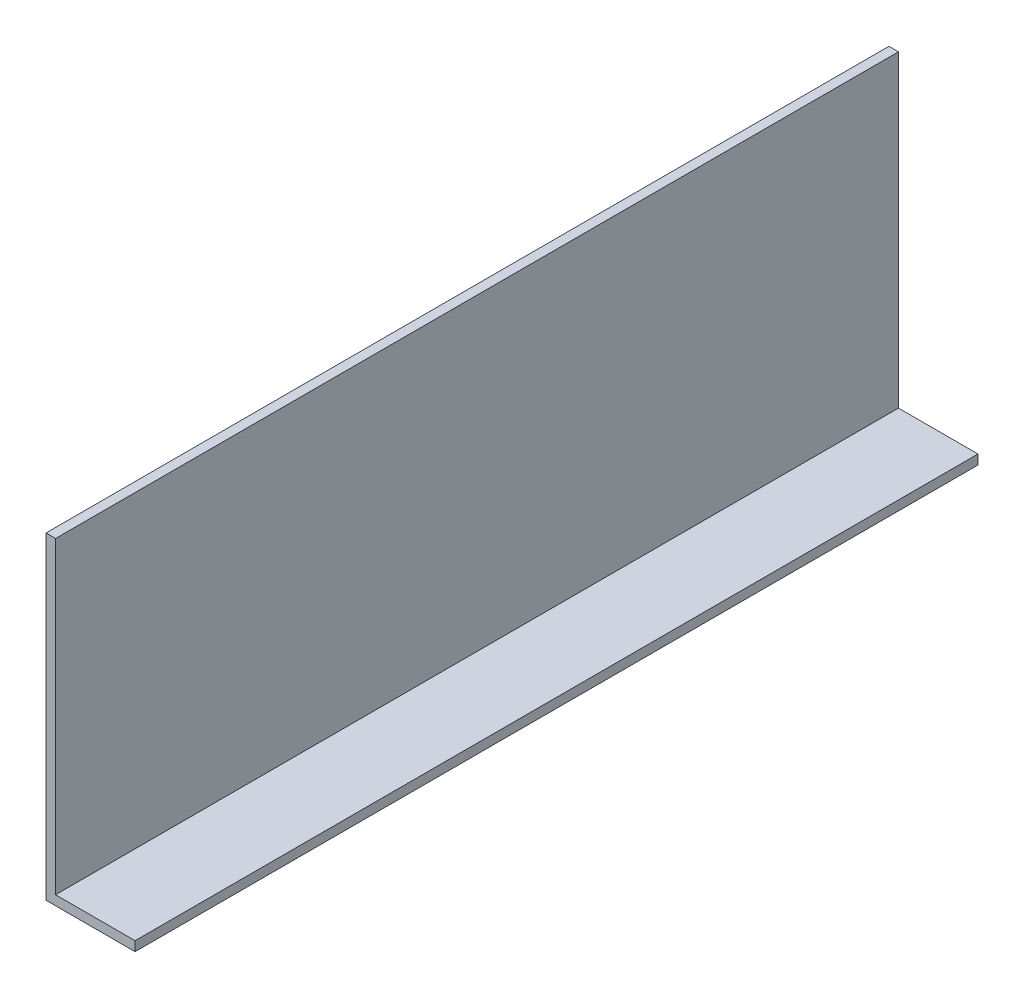
from build123d import *

# Parameters (mm, degrees)
SKETCH1_W           = 530
SKETCH1_H           = 200
BOSS_EXTRUDE1_DEPTH = 3
SKETCH2_W           = 530
SKETCH2_H           = 6
BOSS_EXTRUDE2_DEPTH = 50


with BuildPart() as part:
    # Sketch1 → Boss-Extrude1 (new, symmetric)
    with BuildSketch(Plane(origin=(0, 0, 0), x_dir=(0, 0, -1), z_dir=(1, 0, 0))):
        Rectangle(SKETCH1_W, SKETCH1_H)
    extrude(amount=BOSS_EXTRUDE1_DEPTH, both=True)

    # Sketch2 → Boss-Extrude2 (add)
    with BuildSketch(Plane(origin=(3, 0, 0), x_dir=(0, 0, -1), z_dir=(1, 0, 0))):
        with Locations((0, -97)):
            Rectangle(SKETCH2_W, SKETCH2_H)
    extrude(amount=BOSS_EXTRUDE2_DEPTH)


solid = part.part
